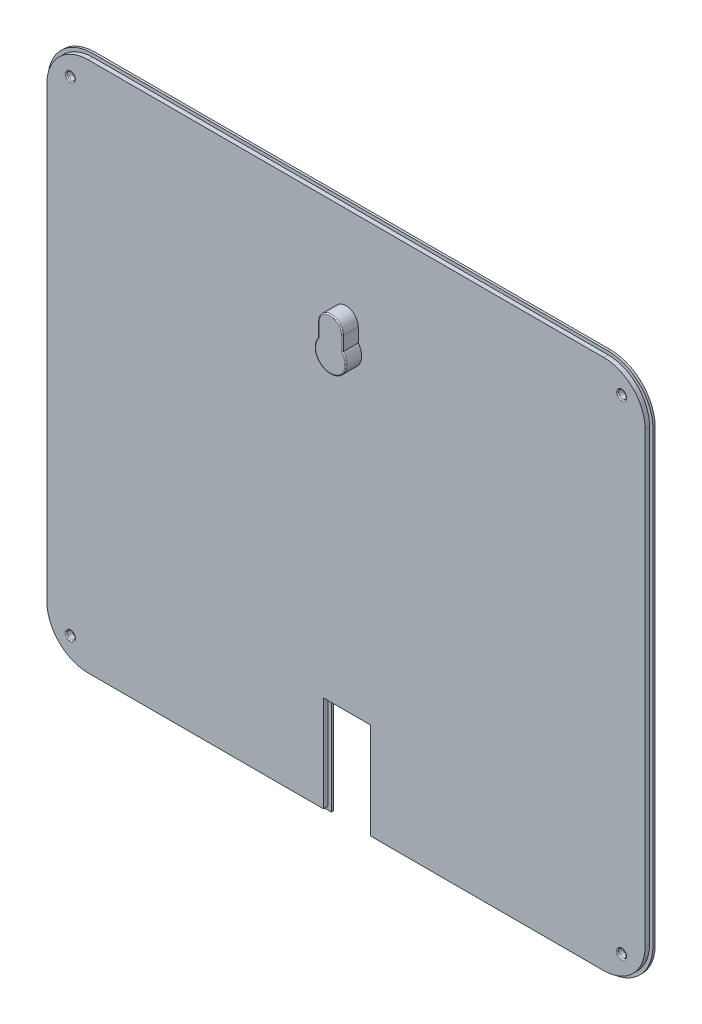
from build123d import *

# Parameters (mm, degrees)
MAIN_BODY_DEPTH       = 3
EDGE_START            = -2
EDGE_CUT_DEPTH        = 2
SKETCH3_W             = 18
SKETCH3_H             = 43
POWER_CABLE_CUT_DEPTH = 3
KEYHOLE_SLOT_DEPTH    = 8
SKETCH7_R             = 5
SKETCH7_R_2           = 1.905
SKETCH7_W             = 3.81
SKETCH7_H             = 9
KEYHOLE_DEPTH         = 3
KEYHOLE_WALL_DEPTH    = 2
SKETCH9_R             = 1.8
SCREW_HOLES_DEPTH     = 3
FILLET1_R             = 0.5


with BuildPart() as part:
    # Sketch1 → Main Body (new body)
    with BuildSketch(Plane.XY):
        with BuildLine():
            Line((-115, 120), (115, 120))
            ThreePointArc((115, 120), (129.142135624, 114.142135624), (135, 100))
            Line((135, 100), (135, -100))
            ThreePointArc((135, -100), (129.142135624, -114.142135624), (115, -120))
            Line((115, -120), (-115, -120))
            ThreePointArc((-115, -120), (-129.142135624, -114.142135624), (-135, -100))
            Line((-135, -100), (-135, 100))
            ThreePointArc((-135, 100), (-129.142135624, 114.142135624), (-115, 120))
        make_face()
    extrude(amount=MAIN_BODY_DEPTH)

    # Sketch2 → Edge Cut (cut)
    with BuildSketch(Plane.XY.offset(3).offset(EDGE_START)):
        with BuildLine():
            Line((-115, 120), (115, 120))
            ThreePointArc((115, 120), (129.142135624, 114.142135624), (135, 100))
            Line((135, 100), (135, -100))
            ThreePointArc((135, -100), (129.142135624, -114.142135624), (115, -120))
            Line((115, -120), (9.5, -120))
            Line((9.5, -120), (9.5, -77.1))
            Line((9.5, -77.1), (-8.5, -77.1))
            Line((-8.5, -77.1), (-8.5, -120))
            Line((-8.5, -120), (-115, -120))
            ThreePointArc((-115, -120), (-129.142135624, -114.142135624), (-135, -100))
            Line((-135, -100), (-135, 100))
            ThreePointArc((-135, 100), (-129.142135624, 114.142135624), (-115, 120))
        make_face()
        with BuildLine():
            Line((-115, 118.5), (115, 118.5))
            ThreePointArc((115, 118.5), (128.081475452, 113.081475452), (133.5, 100))
            Line((133.5, 100), (133.5, -100))
            ThreePointArc((133.5, -100), (128.081475452, -113.081475452), (115, -118.5))
            Line((115, -118.5), (11, -118.5))
            Line((11, -118.5), (11, -75.6))
            Line((11, -75.6), (-10, -75.6))
            Line((-10, -75.6), (-10, -118.5))
            Line((-10, -118.5), (-115, -118.5))
            ThreePointArc((-115, -118.5), (-128.081475452, -113.081475452), (-133.5, -100))
            Line((-133.5, -100), (-133.5, 100))
            ThreePointArc((-133.5, 100), (-128.081475452, 113.081475452), (-115, 118.5))
        make_face(mode=Mode.SUBTRACT)
    extrude(amount=EDGE_CUT_DEPTH, mode=Mode.SUBTRACT)

    # Sketch3 → Power Cable Cut (cut)
    with BuildSketch(Plane.XY.offset(3)):
        with Locations((0.5, -98.5)):
            Rectangle(SKETCH3_W, SKETCH3_H)
    extrude(amount=-POWER_CABLE_CUT_DEPTH, mode=Mode.SUBTRACT)

    # Sketch4 → Keyhole Slot (add)
    with BuildSketch(Plane(origin=(0, 0, 0), x_dir=(-1, 0, 0), z_dir=(0, 0, -1))):
        with BuildLine():
            Line((5.5, 75.5), (5.5, 69.330127019))
            ThreePointArc((5.5, 69.330127019), (0, 58), (-5.5, 69.330127019))
            Line((-5.5, 69.330127019), (-5.5, 75.5))
            ThreePointArc((-5.5, 75.5), (0, 81), (5.5, 75.5))
        make_face()
        with BuildLine():
            Line((3.5, 75.5), (3.5, 68.570714214))
            ThreePointArc((3.5, 68.570714214), (0, 60), (-3.5, 68.570714214))
            Line((-3.5, 68.570714214), (-3.5, 75.5))
            ThreePointArc((-3.5, 75.5), (0, 79), (3.5, 75.5))
        make_face(mode=Mode.SUBTRACT)
    extrude(amount=-KEYHOLE_SLOT_DEPTH)

    # Sketch7 → Keyhole (cut)
    with BuildSketch(Plane(origin=(0, 0, 0), x_dir=(-1, 0, 0), z_dir=(0, 0, -1))):
        with Locations((0, 65)):
            Circle(SKETCH7_R)
        with Locations((0, 74)):
            Circle(SKETCH7_R_2)
        with Locations((0, 69.5)):
            Rectangle(SKETCH7_W, SKETCH7_H)
    extrude(amount=-KEYHOLE_DEPTH, mode=Mode.SUBTRACT)

    # Sketch8 → Keyhole wall (add)
    with BuildSketch(Plane.XY.offset(8)):
        with BuildLine():
            Line((5.5, 69.330127019), (5.5, 75.5))
            ThreePointArc((5.5, 75.5), (0, 81), (-5.5, 75.5))
            Line((-5.5, 75.5), (-5.5, 69.330127019))
            ThreePointArc((-5.5, 69.330127019), (0, 58), (5.5, 69.330127019))
        make_face()
    extrude(amount=KEYHOLE_WALL_DEPTH)

    # Sketch9 → Screw holes (cut)
    with BuildSketch(Plane(origin=(0, 0, 0), x_dir=(-1, 0, 0), z_dir=(0, 0, -1))):
        with Locations((-123, 108)):
            Circle(SKETCH9_R)
        with Locations((-123, -108)):
            Circle(SKETCH9_R)
        with Locations((123, -108)):
            Circle(SKETCH9_R)
        with Locations((123, 108)):
            Circle(SKETCH9_R)
    extrude(amount=-SCREW_HOLES_DEPTH, mode=Mode.SUBTRACT)

    # Fillet1
    fillet1_edges = [part.edges().sort_by_distance(p)[0] for p in [
        (-1.905, 71.811437594, 0),
        (1.905, 71.811437594, 0),
        (0, 60, 0),
        (0, 75.905, 0),
        (5.5, 72.415063509, 10),
        (0, 81, 10),
        (-5.5, 72.415063509, 10),
        (0, 58, 10),
        (-121.2, 108, 3),
        (-121.2, 108, 0),
        (-121.2, -108, 3),
        (-121.2, -108, 0),
        (124.8, -108, 3),
        (124.8, -108, 0),
        (124.8, 108, 3),
        (124.8, 108, 0),
    ]]
    fillet(fillet1_edges, radius=FILLET1_R)


solid = part.part
